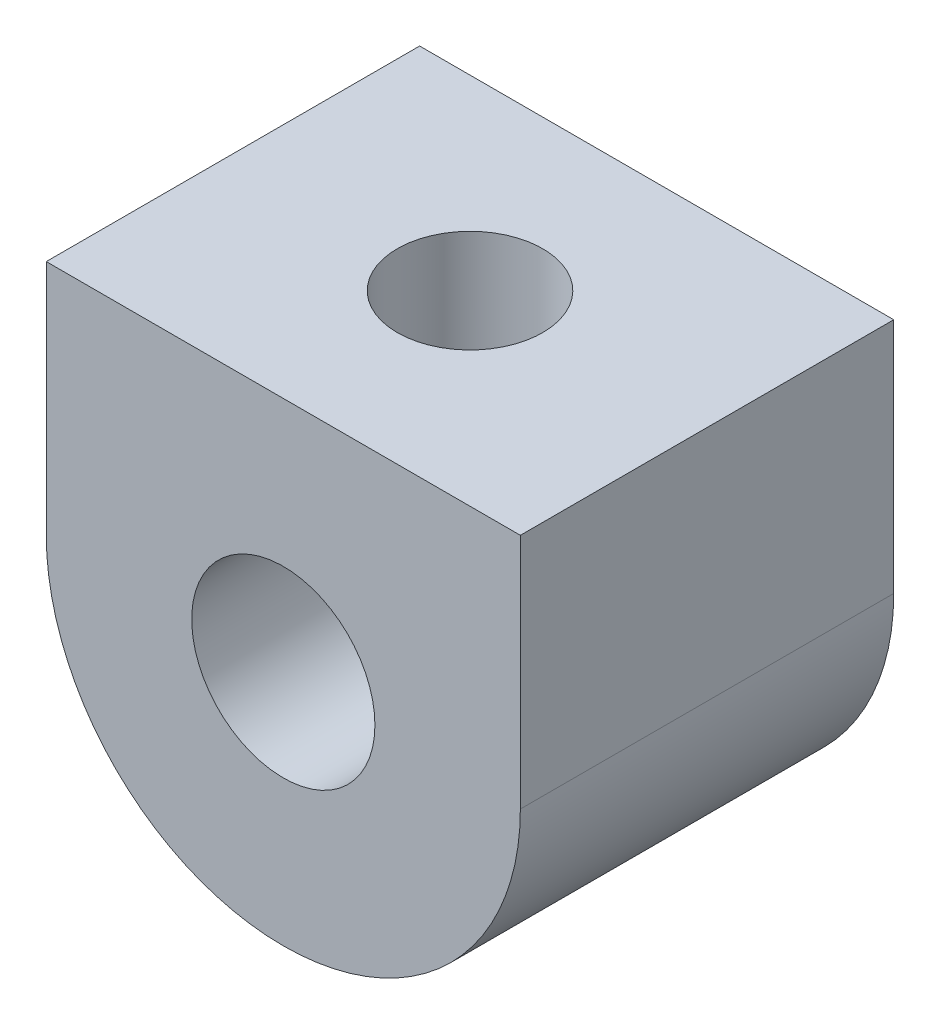
from build123d import *

# Parameters (mm, degrees)
SKETCH2_R               = 3.999992
BOSS_EXTRUDE1_DEPTH     = 16.301974
CUT_EXTRUDE1_REACH      = 30.308
CUT_EXTRUDE1_END_RADIUS = 3.999992
SKETCH3_R               = 3.175


with BuildPart() as part:
    # Sketch2 → Boss-Extrude1 (new body)
    with BuildSketch(Plane.XY):
        with BuildLine():
            Line((-10.349992, 0), (-10.349992, 10.349992))
            Line((-10.349992, 10.349992), (0, 10.349992))
            Line((0, 10.349992), (10.349992, 10.349992))
            Line((10.349992, 10.349992), (10.349992, 0))
            ThreePointArc((10.349992, 0), (0, -10.349992), (-10.349992, 0))
        make_face()
        Circle(SKETCH2_R, mode=Mode.SUBTRACT)
    extrude(amount=BOSS_EXTRUDE1_DEPTH)

    # Cut-Extrude1: up to this cylinder (the profile starts outside it)
    cut_extrude1_end = Plane(origin=(0, 0, 8.150987), z_dir=(0, 0, -1)) * Cylinder(CUT_EXTRUDE1_END_RADIUS, 69.615984, mode=Mode.PRIVATE)
    # Sketch3 → Cut-Extrude1 (cut, up to the surface)
    with BuildSketch(Plane(origin=(0, 10.349992, 0), x_dir=(1, 0, 0), z_dir=(0, 1, 0)), mode=Mode.PRIVATE) as cut_extrude1_sk1:
        with Locations(Location((0, -8.150987, 0), (0, 0, 270))):
            Circle(SKETCH3_R)
    cut_extrude1_tool1 = extrude(cut_extrude1_sk1.sketch, amount=-CUT_EXTRUDE1_REACH, mode=Mode.PRIVATE) - cut_extrude1_end
    add(cut_extrude1_tool1.solids().sort_by_distance((0, 10.349992, 8.150987))[0], mode=Mode.SUBTRACT)


solid = part.part
